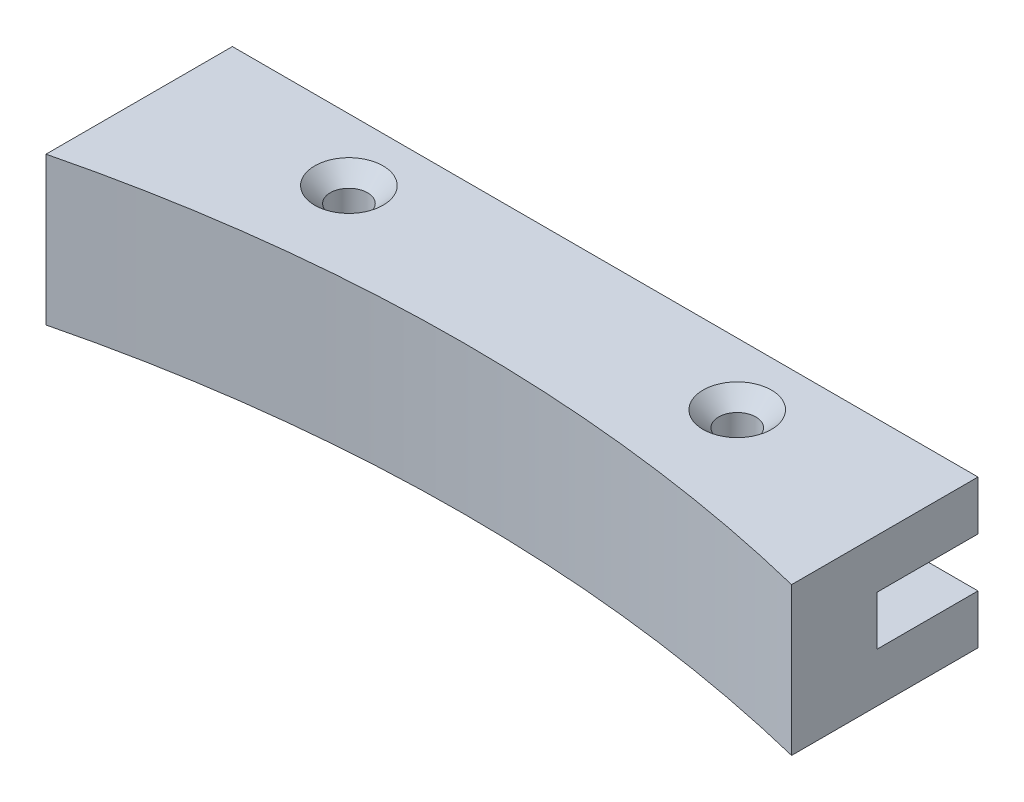
from build123d import *

# Parameters (mm, degrees)
BOSS_EXTRUDE1_DEPTH                             = 4.7625
SKETCH9_W                                       = 6.5
SKETCH9_H                                       = 3.175
CUT_EXTRUDE2_DEPTH                              = 50.705949405
CSK_FOR_M2_FLAT_HEAD_MACHINE_SCREW1_D           = 2.4
CSK_FOR_M2_FLAT_HEAD_MACHINE_SCREW1_DEPTH       = 3.175
CSK_FOR_M2_FLAT_HEAD_MACHINE_SCREW1_CSINK_D     = 4.4
CSK_FOR_M2_FLAT_HEAD_MACHINE_SCREW1_CSINK_ANGLE = 90
M2X0_4_TAPPED_HOLE1_D                           = 1.6


with BuildPart() as part:
    # Sketch1 → Boss-Extrude1 (new, symmetric)
    with BuildSketch(Plane(origin=(0, 0, 0), x_dir=(1, 0, 0), z_dir=(0, 1, 0))):
        with BuildLine():
            Line((-24, 0), (24, 0))
            Line((24, 0), (24, -12))
            ThreePointArc((24, -12), (0, -9.077288796), (-24, -12))
            Line((-24, -12), (-24, 0))
        make_face()
    extrude(amount=BOSS_EXTRUDE1_DEPTH, both=True)

    # Sketch9 → Cut-Extrude2 (cut, through all)
    with BuildSketch(Plane.ZY.offset(24)):
        with Locations((3.25, 0)):
            Rectangle(SKETCH9_W, SKETCH9_H)
    extrude(amount=-CUT_EXTRUDE2_DEPTH, mode=Mode.SUBTRACT)

    # CSK for M2 Flat Head Machine Screw1
    with Locations(Plane(origin=(0, 4.7625, 0), x_dir=(1, 0, 0), z_dir=(0, 1, 0))):
        with Locations((-12.5, -4), (12.5, -4)):
            CounterSinkHole(CSK_FOR_M2_FLAT_HEAD_MACHINE_SCREW1_D / 2, CSK_FOR_M2_FLAT_HEAD_MACHINE_SCREW1_CSINK_D / 2, depth=CSK_FOR_M2_FLAT_HEAD_MACHINE_SCREW1_DEPTH, counter_sink_angle=CSK_FOR_M2_FLAT_HEAD_MACHINE_SCREW1_CSINK_ANGLE)

    # M2x0.4 Tapped Hole1 (through all)
    with Locations(Plane(origin=(0, -1.5875, 0), x_dir=(1, 0, 0), z_dir=(0, 1, 0))):
        with Locations((-12.5, -4), (12.5, -4)):
            Hole(M2X0_4_TAPPED_HOLE1_D / 2)


solid = part.part
